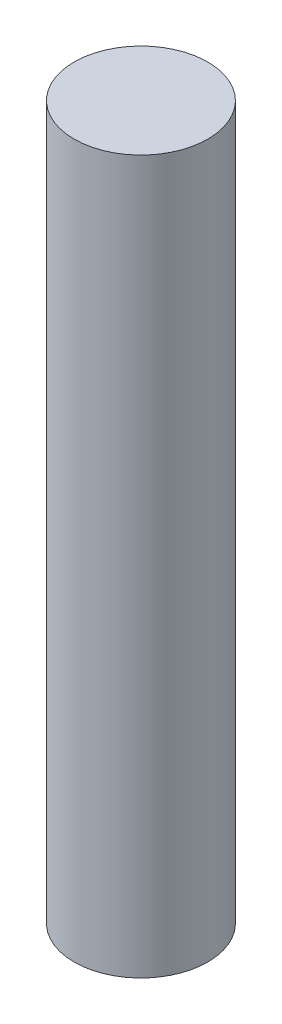
from build123d import *

# Parameters (mm, degrees)
IZIM1_R                     = 7.5
Y_KSEKLIK_EKSTR_ZYON1_DEPTH = 80


with BuildPart() as part:
    # Çizim1 → Yükseklik-Ekstrüzyon1 (new body)
    with BuildSketch(Plane(origin=(0, 0, 0), x_dir=(1, 0, 0), z_dir=(0, 1, 0))):
        with Locations(Location((0, 0, 0), (0, 0, 270))):
            Circle(IZIM1_R)
    extrude(amount=Y_KSEKLIK_EKSTR_ZYON1_DEPTH)


solid = part.part
